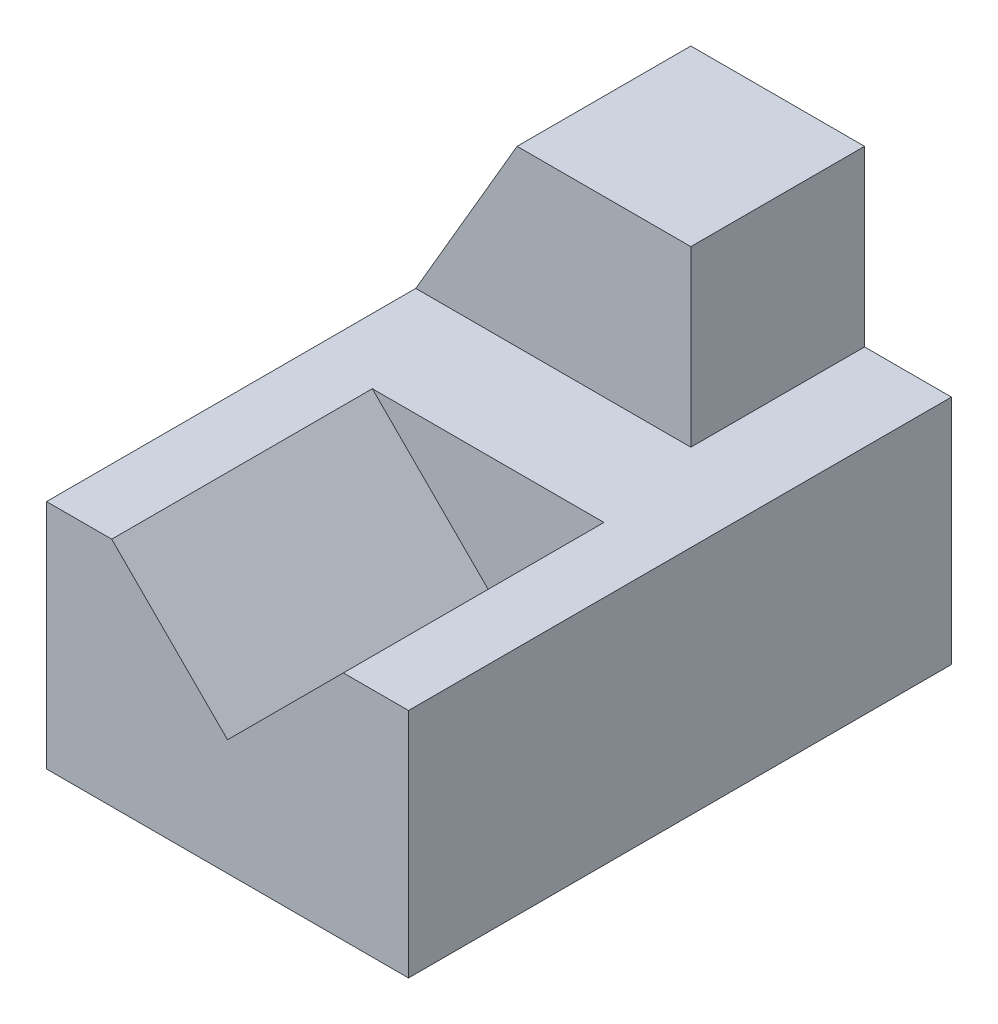
from build123d import *

# Parameters (mm, degrees)
BOSS_EXTRUDE1_DEPTH = 75
BOSS_EXTRUDE2_DEPTH = 39
BOSS_EXTRUDE3_DEPTH = 24


with BuildPart() as part:
    # Sketch1 → Boss-Extrude1 (new body)
    with BuildSketch(Plane.XY):
        Polygon((-25, 16), (-41, 32), (-50, 32), (-50, 0), (0, 0), (0, 32), (-9, 32), align=None)
    extrude(amount=BOSS_EXTRUDE1_DEPTH)

    # Sketch1<3> → Boss-Extrude2 (add)
    with BuildSketch(Plane.XY):
        Polygon((-12, 32), (-41, 32), (-25, 16), (-9, 32), align=None)
    extrude(amount=BOSS_EXTRUDE2_DEPTH)

    # Sketch1<4> → Boss-Extrude3 (add)
    with BuildSketch(Plane.XY):
        Polygon((-50, 32), (-41, 32), (-12, 32), (-12, 56), (-36, 56), align=None)
    extrude(amount=BOSS_EXTRUDE3_DEPTH)


solid = part.part
